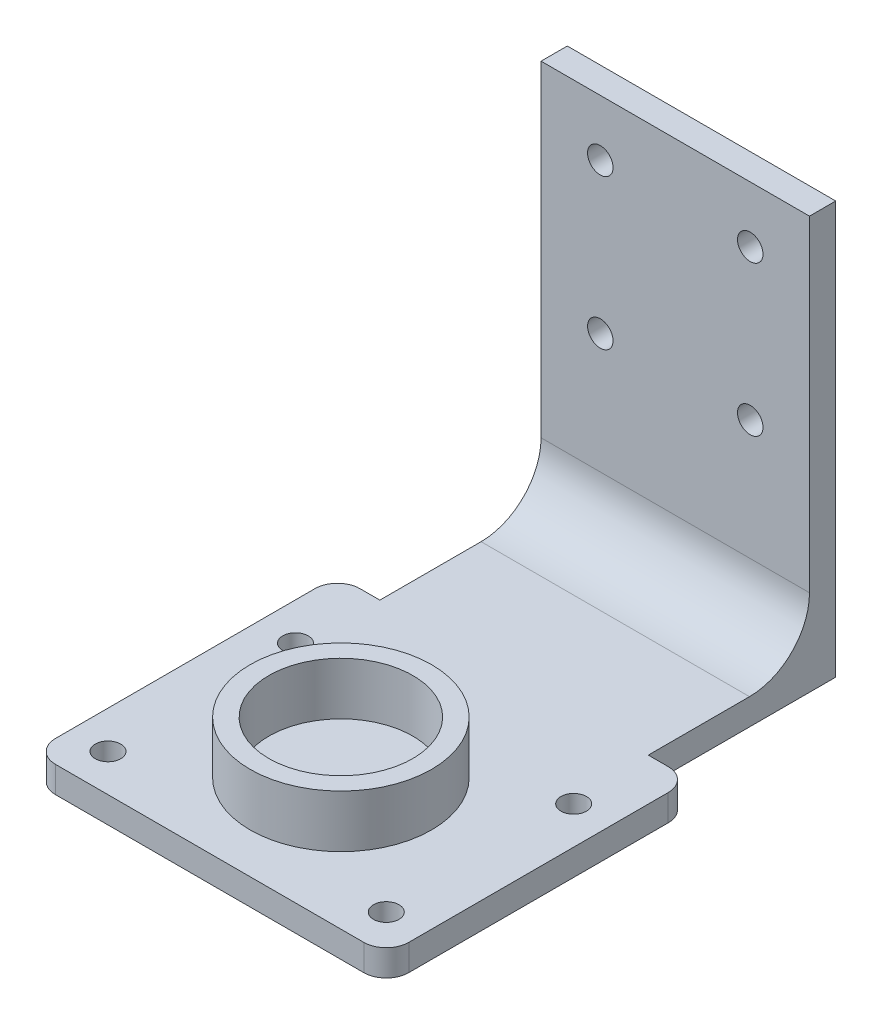
from build123d import *

# Parameters (mm, degrees)
SKETCH1_R           = 1.7
BOSS_EXTRUDE1_DEPTH = 3.5
SKETCH2_R           = 12.1
SKETCH2_R_2         = 9.6
BOSS_EXTRUDE2_DEPTH = 7
SKETCH3_W           = 47.11
SKETCH3_H           = 55
BOSS_EXTRUDE3_DEPTH = 3.5
SKETCH4_R           = 1.7
CUT_EXTRUDE1_DEPTH  = 89.787375369
SKETCH5_W           = 5.655
SKETCH5_H           = 25
CUT_EXTRUDE2_DEPTH  = 77.768795907
FILLET3_R           = 3
FILLET4_R           = 8


with BuildPart() as part:
    # Sketch1 → Boss-Extrude1 (new body)
    with BuildSketch(Plane(origin=(0, 0, 0), x_dir=(1, 0, 0), z_dir=(0, 1, 0))):
        Polygon((-23.555, 17.5), (-23.555, -17.5), (23.555, -17.5), (23.555, 17.5), (23.555, 44.6), (-23.555, 44.6), align=None)
        with Locations(Location((-18.555, -12.5, 0), (0, 0, 270))):
            Circle(SKETCH1_R, mode=Mode.SUBTRACT)
        with Locations(Location((-18.555, 12.5, 0), (0, 0, 90))):
            Circle(SKETCH1_R, mode=Mode.SUBTRACT)
        with Locations(Location((18.555, -12.5, 0), (0, 0, 90))):
            Circle(SKETCH1_R, mode=Mode.SUBTRACT)
        with Locations(Location((18.555, 12.5, 0), (0, 0, 270))):
            Circle(SKETCH1_R, mode=Mode.SUBTRACT)
    extrude(amount=BOSS_EXTRUDE1_DEPTH)

    # Sketch2 → Boss-Extrude2 (add)
    with BuildSketch(Plane(origin=(0, 3.5, 0), x_dir=(1, 0, 0), z_dir=(0, 1, 0))):
        with Locations(Location((0, 0, 0), (0, 0, 90))):
            Circle(SKETCH2_R)
        with Locations(Location((0, 0, 0), (0, 0, 270))):
            Circle(SKETCH2_R_2, mode=Mode.SUBTRACT)
    extrude(amount=BOSS_EXTRUDE2_DEPTH)

    # Sketch3 → Boss-Extrude3 (add)
    with BuildSketch(Plane(origin=(0, 0, -44.6), x_dir=(-1, 0, 0), z_dir=(0, 0, -1))):
        with Locations((0, 27.5)):
            Rectangle(SKETCH3_W, SKETCH3_H)
    extrude(amount=BOSS_EXTRUDE3_DEPTH)

    # Sketch4 → Cut-Extrude1 (cut, through all)
    with BuildSketch(Plane(origin=(0, 0, -48.1), x_dir=(-1, 0, 0), z_dir=(0, 0, -1))):
        with Locations((-10, 47.5)):
            Circle(SKETCH4_R)
        with Locations((-10, 27.5)):
            Circle(SKETCH4_R)
        with Locations((10, 27.5)):
            Circle(SKETCH4_R)
        with Locations((10, 47.5)):
            Circle(SKETCH4_R)
    extrude(amount=-CUT_EXTRUDE1_DEPTH, mode=Mode.SUBTRACT)

    # Sketch5 → Cut-Extrude2 (cut, through all)
    with BuildSketch(Plane(origin=(0, 55, 0), x_dir=(1, 0, 0), z_dir=(0, 1, 0))):
        with Locations((-20.7275, 35.6)):
            Rectangle(SKETCH5_W, SKETCH5_H)
        with Locations((20.7275, 35.6)):
            Rectangle(SKETCH5_W, SKETCH5_H)
    extrude(amount=-CUT_EXTRUDE2_DEPTH, mode=Mode.SUBTRACT)

    # Fillet3
    fillet3_edges = [part.edges().sort_by_distance(p)[0] for p in [
        (23.555, 1.75, -23.1),
        (23.555, 1.75, 17.5),
        (-23.555, 1.75, 17.5),
        (-23.555, 1.75, -23.1),
    ]]
    fillet(fillet3_edges, radius=FILLET3_R)

    # Fillet4
    fillet4_edges = [part.edges().sort_by_distance(p)[0] for p in [
        (0, 3.5, -44.6),
    ]]
    fillet(fillet4_edges, radius=FILLET4_R)


solid = part.part
